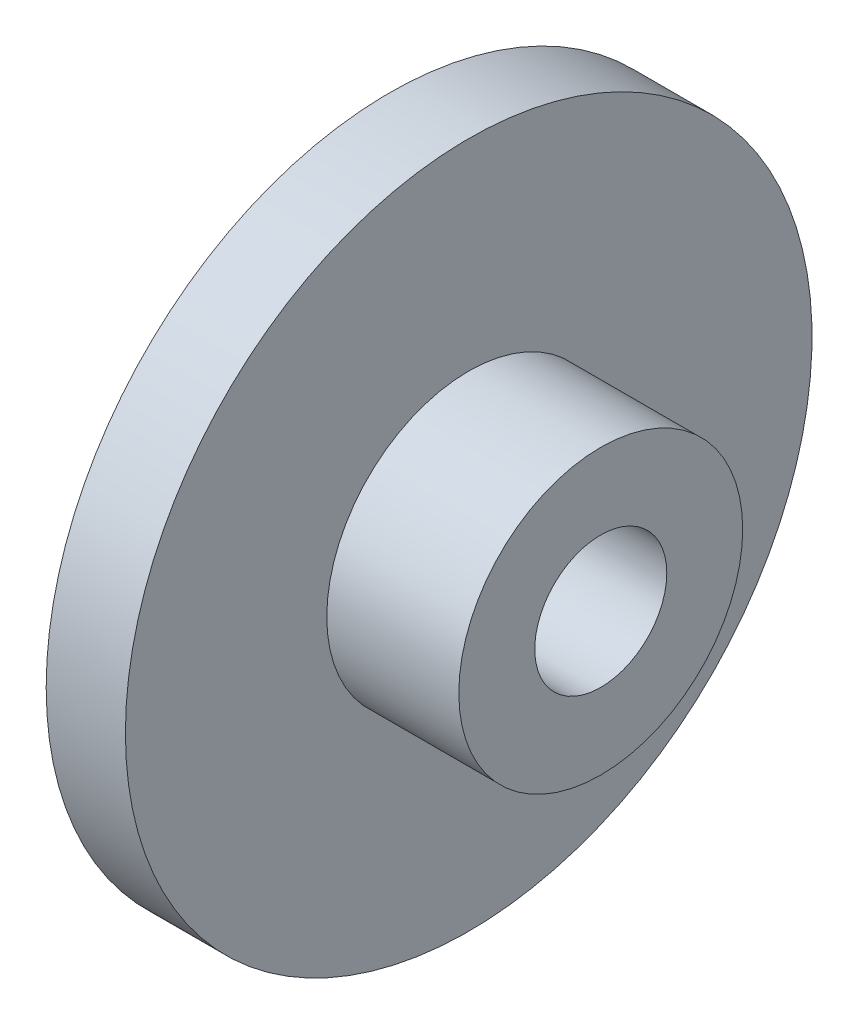
from build123d import *

# Parameters (mm, degrees)
SKETCH1_R                          = 20.6375
BOSS_EXTRUDE1_DEPTH                = 4.7625
SKETCH2_R                          = 8.5328125
BOSS_EXTRUDE2_DEPTH                = 7.9375
F_5_16_0_3125_DIAMETER_HOLE1_D     = 7.9375
F_5_16_0_3125_DIAMETER_HOLE1_DEPTH = 70.104
F_5_16_0_3125_DIAMETER_HOLE1_TIP   = 2.384665582


with BuildPart() as part:
    # Sketch1 → Boss-Extrude1 (new body)
    with BuildSketch(Plane(origin=(0, 0, 0), x_dir=(0, 0, -1), z_dir=(1, 0, 0))):
        with Locations(Location((0, 0, 0), (0, 0, 180))):
            Circle(SKETCH1_R)
    extrude(amount=BOSS_EXTRUDE1_DEPTH)

    # Sketch2 → Boss-Extrude2 (add)
    with BuildSketch(Plane(origin=(4.7625, 0, 0), x_dir=(0, 0, -1), z_dir=(1, 0, 0))):
        Circle(SKETCH2_R)
    extrude(amount=BOSS_EXTRUDE2_DEPTH)

    # 5/16 (0.3125) Diameter Hole1
    with Locations(Plane(origin=(12.7, 0, 0), x_dir=(0, 0, -1), z_dir=(1, 0, 0))):
        with Locations((0, 0)):
            Hole(F_5_16_0_3125_DIAMETER_HOLE1_D / 2, depth=F_5_16_0_3125_DIAMETER_HOLE1_DEPTH)
            with Locations((0, 0, -(F_5_16_0_3125_DIAMETER_HOLE1_DEPTH + F_5_16_0_3125_DIAMETER_HOLE1_TIP / 2))):  # 118° drill point
                Cone(0, F_5_16_0_3125_DIAMETER_HOLE1_D / 2, F_5_16_0_3125_DIAMETER_HOLE1_TIP, mode=Mode.SUBTRACT)


solid = part.part
